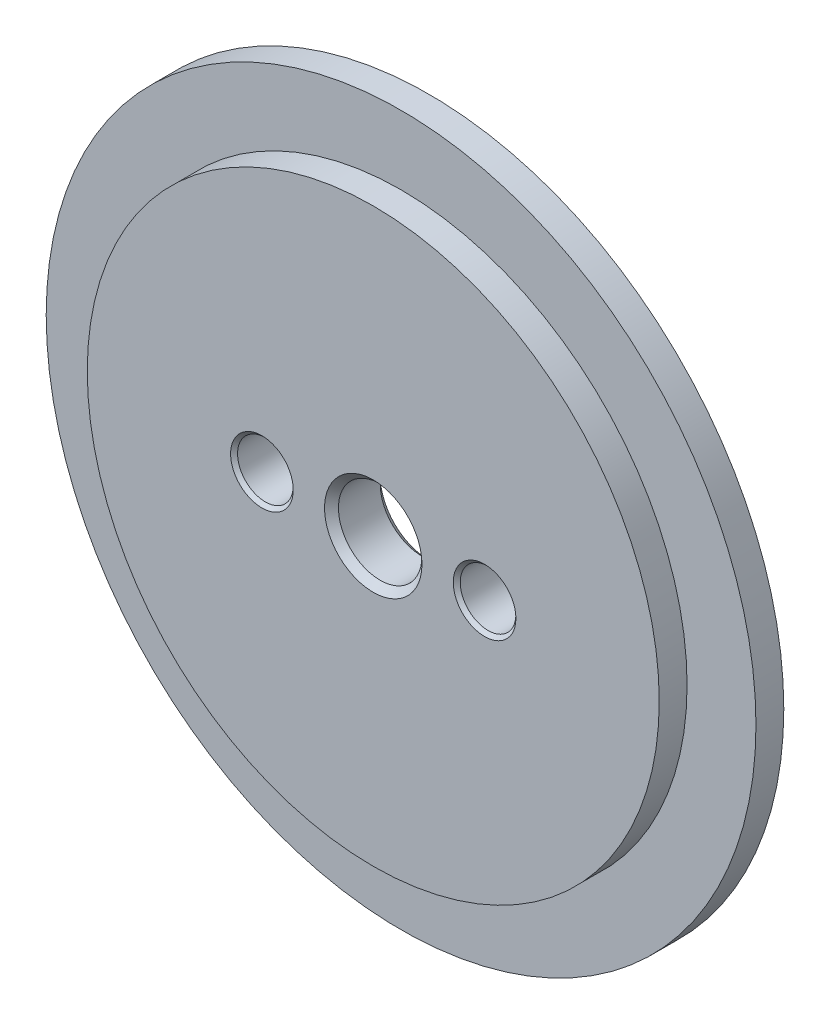
from build123d import *

# Parameters (mm, degrees)
SKETCH1_R           = 25.5
BOSS_EXTRUDE1_DEPTH = 2
SKETCH2_R           = 20.55
BOSS_EXTRUDE2_DEPTH = 2
SKETCH3_R           = 3
SKETCH3_R_2         = 2
CUT_EXTRUDE1_DEPTH  = 37.283605113
CHAMFER1_SIZE       = 0.25
CHAMFER2_SIZE       = 0.25
CHAMFER3_SIZE       = 0.5


with BuildPart() as part:
    # Sketch1 → Boss-Extrude1 (new body)
    with BuildSketch(Plane.XY):
        Circle(SKETCH1_R)
    extrude(amount=BOSS_EXTRUDE1_DEPTH)

    # Sketch2 → Boss-Extrude2 (add)
    with BuildSketch(Plane.XY.offset(2)):
        Circle(SKETCH2_R)
    extrude(amount=BOSS_EXTRUDE2_DEPTH)

    # Sketch3 → Cut-Extrude1 (cut, through all)
    with BuildSketch(Plane(origin=(0, 0, 0), x_dir=(-1, 0, 0), z_dir=(0, 0, -1))):
        Circle(SKETCH3_R)
        with Locations((8, 0)):
            Circle(SKETCH3_R_2)
        with Locations((-8, 0)):
            Circle(SKETCH3_R_2)
    extrude(amount=-CUT_EXTRUDE1_DEPTH, mode=Mode.SUBTRACT)

    # Chamfer1
    chamfer1_edges = [part.edges().sort_by_distance(p)[0] for p in [
        (10, 0, 4),
        (10, 0, 0),
    ]]
    chamfer(chamfer1_edges, length=CHAMFER1_SIZE)

    # Chamfer2
    chamfer2_edges = [part.edges().sort_by_distance(p)[0] for p in [
        (-6, 0, 4),
        (-6, 0, 0),
    ]]
    chamfer(chamfer2_edges, length=CHAMFER2_SIZE)

    # Chamfer3
    chamfer3_edges = [part.edges().sort_by_distance(p)[0] for p in [
        (3, 0, 4),
        (3, 0, 0),
    ]]
    chamfer(chamfer3_edges, length=CHAMFER3_SIZE)


solid = part.part
